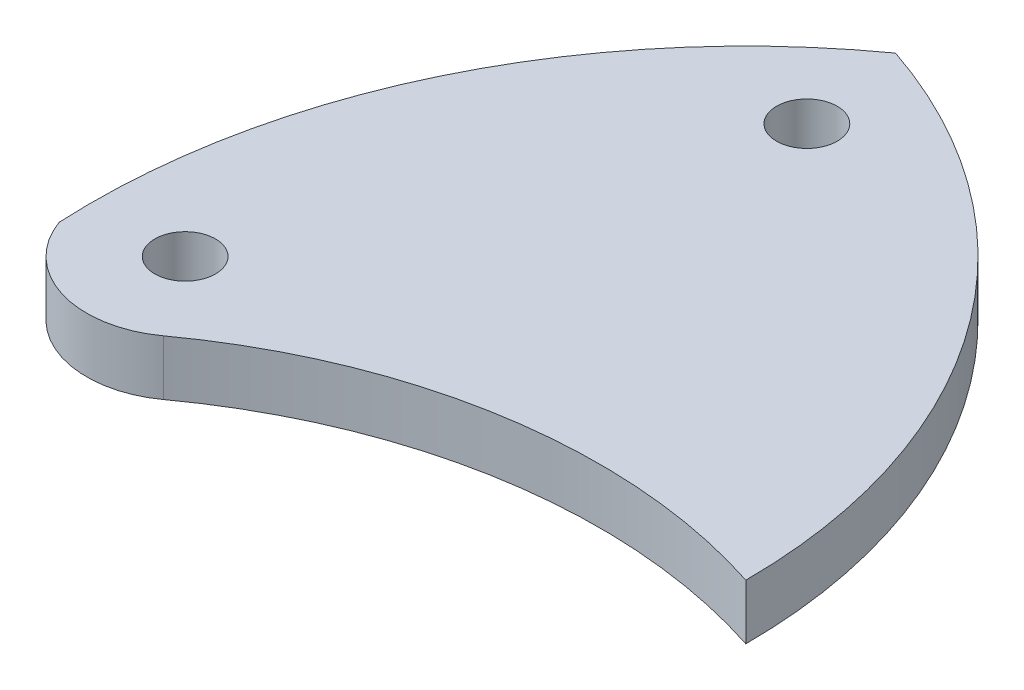
from build123d import *

# Parameters (mm, degrees)
SKETCH1_R           = 3.3
BOSS_EXTRUDE1_DEPTH = 6


with BuildPart() as part:
    # Sketch1 → Boss-Extrude1 (new body)
    with BuildSketch(Plane(origin=(0, 0, 0), x_dir=(1, 0, 0), z_dir=(0, 1, 0))):
        with BuildLine():
            ThreePointArc((0, 0), (-11.446284728, 35.56), (-41.486666667, 57.76600115))
            ThreePointArc((-41.486666667, 57.76600115), (-64.088327188, 30.834083711), (-71.027120603, -3.6335298))
            ThreePointArc((-71.027120603, -3.6335298), (-64.102936802, -10.230904374), (-54.669064957, -8.658729256))
            ThreePointArc((-54.669064957, -8.658729256), (-28.373920966, 2.233076009), (0, 0))
        make_face()
        with Locations((-39.657897042, 46.296574351)):
            Circle(SKETCH1_R, mode=Mode.SUBTRACT)
        with Locations((-60.96, 0)):
            Circle(SKETCH1_R, mode=Mode.SUBTRACT)
    extrude(amount=BOSS_EXTRUDE1_DEPTH)


solid = part.part
